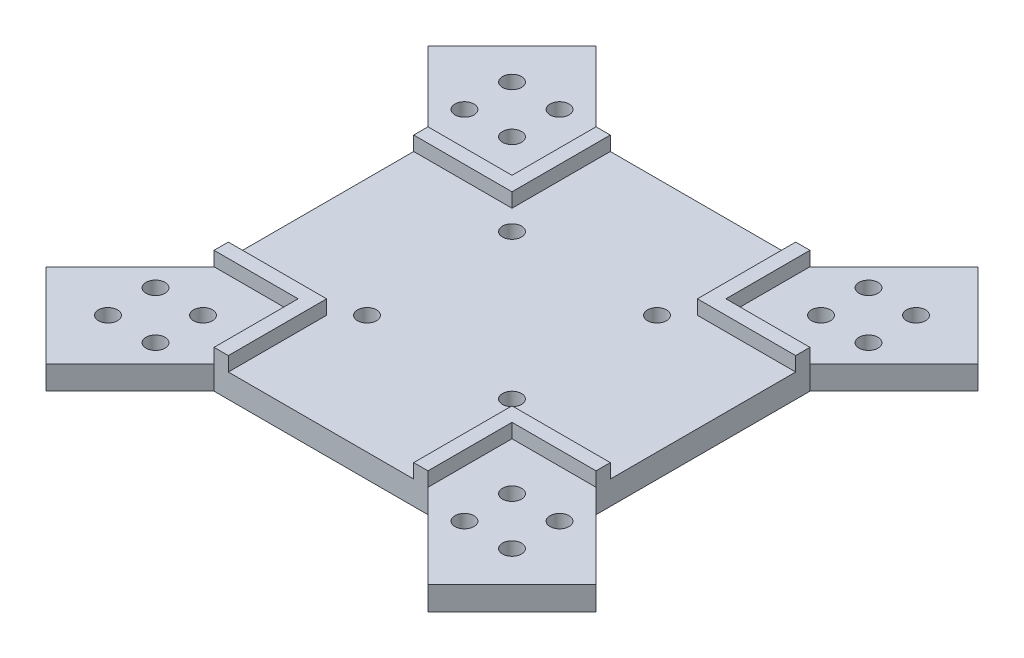
from build123d import *

# Parameters (mm, degrees)
EXTRUDE_1_DEPTH     = 5
EXTRUDE_2_DEPTH     = 3
SKETCH_4_R          = 2
CUT_EXTRUDE_1_DEPTH = 5
SKETCH_6_R          = 2
CUT_EXTRUDE_2_DEPTH = 5


with BuildPart() as part:
    # 스케치1 → 보스-돌출1 (new body)
    with BuildSketch(Plane(origin=(0, 0, 0), x_dir=(1, 0, 0), z_dir=(0, 1, 0))):
        Polygon((-40.17766953, 22.5), (-57.855339059, 40.17766953), (-40.17766953, 57.855339059), (-22.5, 40.17766953), align=None)
        Polygon((-22.5, 40.17766953), (22.5, -40.17766953), (-22.5, -40.17766953), (-40.17766953, -22.5), (-40.17766953, 22.5), align=None)
        Polygon((-40.17766953, -57.855339059), (-57.855339059, -40.17766953), (-40.17766953, -22.5), (-22.5, -40.17766953), align=None)
        Polygon((-22.5, 40.17766953), (22.5, 40.17766953), (40.17766953, 22.5), (40.17766953, -22.5), (22.5, -40.17766953), align=None)
        Polygon((40.17766953, -57.855339059), (22.5, -40.17766953), (40.17766953, -22.5), (57.855339059, -40.17766953), align=None)
        Polygon((40.17766953, 22.5), (22.5, 40.17766953), (40.17766953, 57.855339059), (57.855339059, 40.17766953), align=None)
    extrude(amount=EXTRUDE_1_DEPTH)

    # 스케치2 → 보스-돌출2 (add)
    with BuildSketch(Plane(origin=(0, 5, 0), x_dir=(1, 0, 0), z_dir=(0, 1, 0))):
        Polygon((-40.17766953, -19.5), (-40.17766953, -22.5), (-22.5, -22.5), (-22.5, -40.17766953), (-19.5, -40.17766953), (-19.5, -19.5), align=None)
        Polygon((-19.5, 40.17766953), (-22.5, 40.17766953), (-22.5, 22.5), (-40.17766953, 22.5), (-40.17766953, 19.5), (-19.5, 19.5), align=None)
        Polygon((40.17766953, 19.5), (40.17766953, 22.5), (22.5, 22.5), (22.5, 40.17766953), (19.5, 40.17766953), (19.5, 19.5), align=None)
        Polygon((19.5, -40.17766953), (22.5, -40.17766953), (22.5, -22.5), (40.17766953, -22.5), (40.17766953, -19.5), (19.5, -19.5), align=None)
    extrude(amount=EXTRUDE_2_DEPTH)

    # 스케치4 → 컷-돌출1 (cut)
    with BuildSketch(Plane(origin=(0, 0, 0), x_dir=(1, 0, 0), z_dir=(0, 1, 0))):
        with Locations(Location((-42.5, -42.5, 0), (0, 0, 270))):
            Circle(SKETCH_4_R)
        with Locations(Location((-32.5, -42.5, 0), (0, 0, 270))):
            Circle(SKETCH_4_R)
        with Locations(Location((-42.5, -32.5, 0), (0, 0, 270))):
            Circle(SKETCH_4_R)
        with Locations(Location((-32.5, -32.5, 0), (0, 0, 270))):
            Circle(SKETCH_4_R)
        with Locations(Location((-32.5, 32.5, 0), (0, 0, 270))):
            Circle(SKETCH_4_R)
        with Locations(Location((-42.5, 32.5, 0), (0, 0, 270))):
            Circle(SKETCH_4_R)
        with Locations(Location((-42.5, 42.5, 0), (0, 0, 270))):
            Circle(SKETCH_4_R)
        with Locations(Location((-32.5, 42.5, 0), (0, 0, 270))):
            Circle(SKETCH_4_R)
        with Locations(Location((32.5, 32.5, 0), (0, 0, 270))):
            Circle(SKETCH_4_R)
        with Locations(Location((32.5, 42.5, 0), (0, 0, 270))):
            Circle(SKETCH_4_R)
        with Locations(Location((42.5, 42.5, 0), (0, 0, 270))):
            Circle(SKETCH_4_R)
        with Locations(Location((42.5, 32.5, 0), (0, 0, 270))):
            Circle(SKETCH_4_R)
        with Locations(Location((32.5, -32.5, 0), (0, 0, 270))):
            Circle(SKETCH_4_R)
        with Locations(Location((42.5, -32.5, 0), (0, 0, 270))):
            Circle(SKETCH_4_R)
        with Locations(Location((42.5, -42.5, 0), (0, 0, 270))):
            Circle(SKETCH_4_R)
        with Locations(Location((32.5, -42.5, 0), (0, 0, 270))):
            Circle(SKETCH_4_R)
    extrude(amount=CUT_EXTRUDE_1_DEPTH, mode=Mode.SUBTRACT)

    # 스케치6 → 컷-돌출2 (cut)
    with BuildSketch(Plane(origin=(0, 0, 0), x_dir=(1, 0, 0), z_dir=(0, 1, 0))):
        with Locations(Location((-15.25, 15.25, 0), (0, 0, 270))):
            Circle(SKETCH_6_R)
        with Locations(Location((15.25, -15.25, 0), (0, 0, 270))):
            Circle(SKETCH_6_R)
        with Locations(Location((15.25, 15.25, 0), (0, 0, 270))):
            Circle(SKETCH_6_R)
        with Locations(Location((-15.25, -15.25, 0), (0, 0, 270))):
            Circle(SKETCH_6_R)
    extrude(amount=CUT_EXTRUDE_2_DEPTH, mode=Mode.SUBTRACT)


solid = part.part
